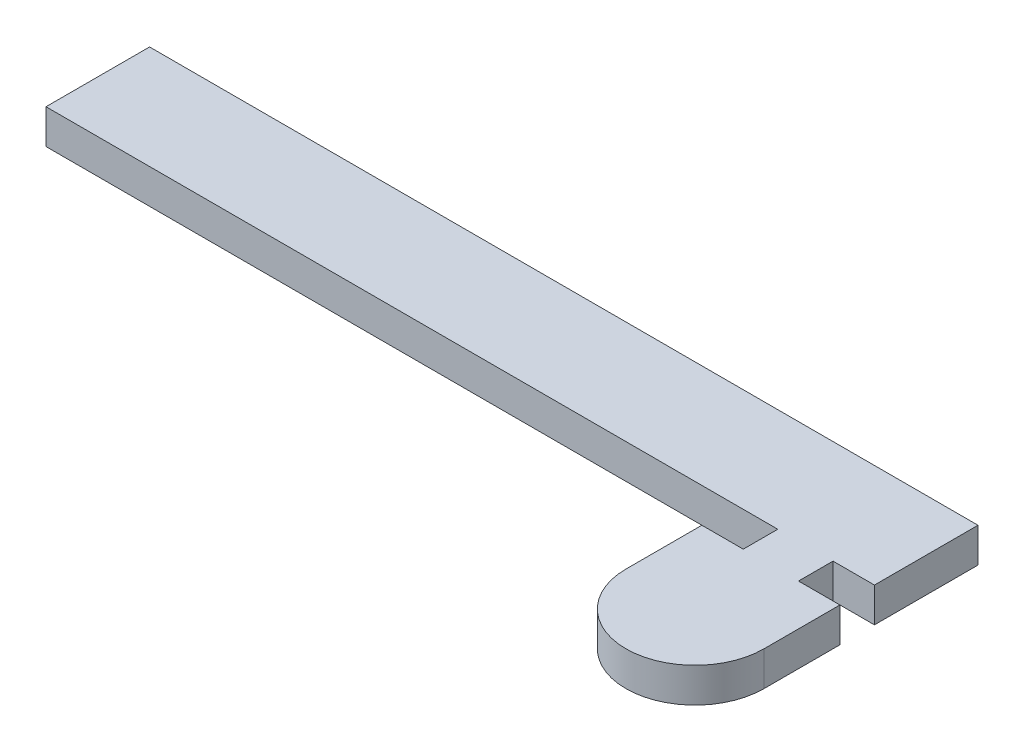
from build123d import *

# Parameters (mm, degrees)
RESSALTO_EXTRUS_O1_DEPTH = 5
ESBO_O2_W                = 6
ESBO_O2_H                = 5
CORTE_EXTRUS_O1_DEPTH    = 10
ESBO_O3_W                = 120
ESBO_O3_H                = 15
RESSALTO_EXTRUS_O2_DEPTH = 5


with BuildPart() as part:
    # Esboço1 → Ressalto-extrusão1 (new body)
    with BuildSketch(Plane(origin=(0, 0, 0), x_dir=(1, 0, 0), z_dir=(0, 1, 0))):
        with BuildLine():
            ThreePointArc((-17.839278071, -21.26900995), (-27.839278071, -11.26900995), (-37.839278071, -21.26900995))
            Line((-37.839278071, -21.26900995), (-17.839278071, -21.26900995))
        make_face()
        with BuildLine():
            Line((-17.839278071, -21.26900995), (-37.839278071, -21.26900995))
            ThreePointArc((-37.839278071, -21.26900995), (-27.839278071, -31.26900995), (-17.839278071, -21.26900995))
        make_face()
        with BuildLine():
            Line((-17.839278071, -5.26900995), (-37.839278071, -5.26900995))
            Line((-37.839278071, -5.26900995), (-37.839278071, -21.26900995))
            ThreePointArc((-37.839278071, -21.26900995), (-27.839278071, -11.26900995), (-17.839278071, -21.26900995))
            Line((-17.839278071, -21.26900995), (-17.839278071, -5.26900995))
        make_face()
    extrude(amount=RESSALTO_EXTRUS_O1_DEPTH)

    # Esboço2 → Corte-extrusão1 (cut)
    with BuildSketch(Plane(origin=(0, 5, 0), x_dir=(1, 0, 0), z_dir=(0, 1, 0))):
        with Locations((-34.839278071, -7.76900995)):
            Rectangle(ESBO_O2_W, ESBO_O2_H)
        with Locations((-20.839278071, -7.76900995)):
            Rectangle(ESBO_O2_W, ESBO_O2_H)
    extrude(amount=-CORTE_EXTRUS_O1_DEPTH, mode=Mode.SUBTRACT)

    # Esboço3 → Ressalto-extrusão2 (add)
    with BuildSketch(Plane(origin=(0, 5, 0), x_dir=(1, 0, 0), z_dir=(0, 1, 0))):
        with Locations((-77.839278071, 2.23099005)):
            Rectangle(ESBO_O3_W, ESBO_O3_H)
    extrude(amount=-RESSALTO_EXTRUS_O2_DEPTH)


solid = part.part
